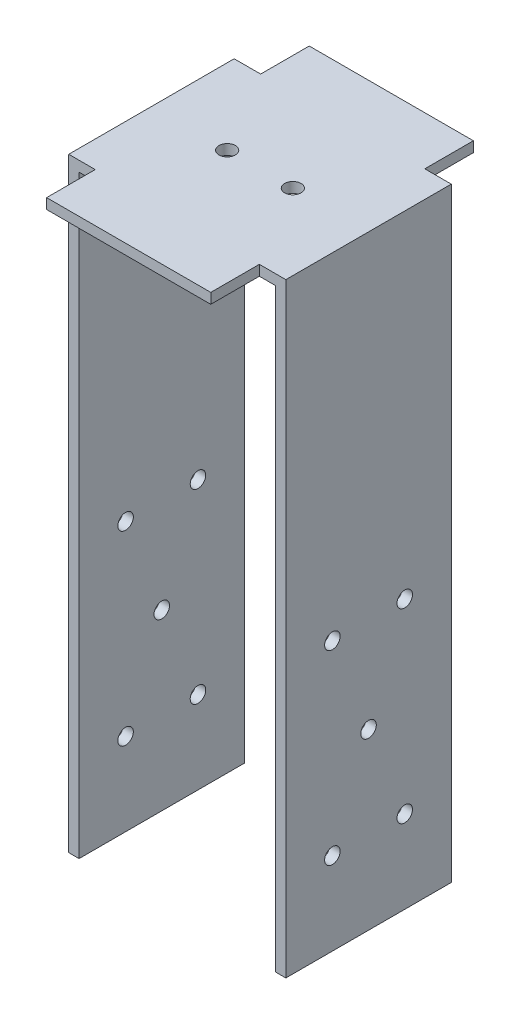
from build123d import *

# Parameters (mm, degrees)
BOSS_EXTRUDE1_DEPTH = 2
SKETCH2_W           = 2
SKETCH2_H           = 32
BOSS_EXTRUDE2_DEPTH = 115
SKETCH3_R           = 1.5
CUT_EXTRUDE1_DEPTH  = 127.878524582
SKETCH4_R           = 1.5875
CUT_EXTRUDE2_DEPTH  = 122.553115962


with BuildPart() as part:
    # Sketch1 → Boss-Extrude1 (new body)
    with BuildSketch(Plane(origin=(0, 0, 0), x_dir=(1, 0, 0), z_dir=(0, 1, 0))):
        Polygon((-21, 16), (-15.875, 16), (-15.875, 25.4), (15.875, 25.4), (15.875, 16), (21, 16), (21, -16), (15.875, -16), (15.875, -25.4), (-15.875, -25.4), (-15.875, -16), (-21, -16), align=None)
    extrude(amount=-BOSS_EXTRUDE1_DEPTH)

    # Sketch2 → Boss-Extrude2 (add)
    with BuildSketch(Plane.XZ.offset(2)):
        with Locations((-20, 0)):
            Rectangle(SKETCH2_W, SKETCH2_H)
        with Locations((20, 0)):
            Rectangle(SKETCH2_W, SKETCH2_H)
    extrude(amount=BOSS_EXTRUDE2_DEPTH)

    # Sketch3 → Cut-Extrude1 (cut, through all)
    with BuildSketch(Plane.ZY.offset(21)):
        with Locations((-7, -65)):
            Circle(SKETCH3_R)
        with Locations((7, -65)):
            Circle(SKETCH3_R)
        with Locations((7, -101)):
            Circle(SKETCH3_R)
        with Locations((-7, -101)):
            Circle(SKETCH3_R)
        with Locations((0, -83.336478267)):
            Circle(SKETCH3_R)
    extrude(amount=-CUT_EXTRUDE1_DEPTH, mode=Mode.SUBTRACT)

    # Sketch4 → Cut-Extrude2 (cut, through all)
    with BuildSketch(Plane(origin=(0, 0, 0), x_dir=(1, 0, 0), z_dir=(0, 1, 0))):
        with Locations(Location((-6.35, 0, 0), (0, 0, 270))):
            Circle(SKETCH4_R)
        with Locations(Location((6.35, 0, 0), (0, 0, 270))):
            Circle(SKETCH4_R)
    extrude(amount=-CUT_EXTRUDE2_DEPTH, mode=Mode.SUBTRACT)


solid = part.part
